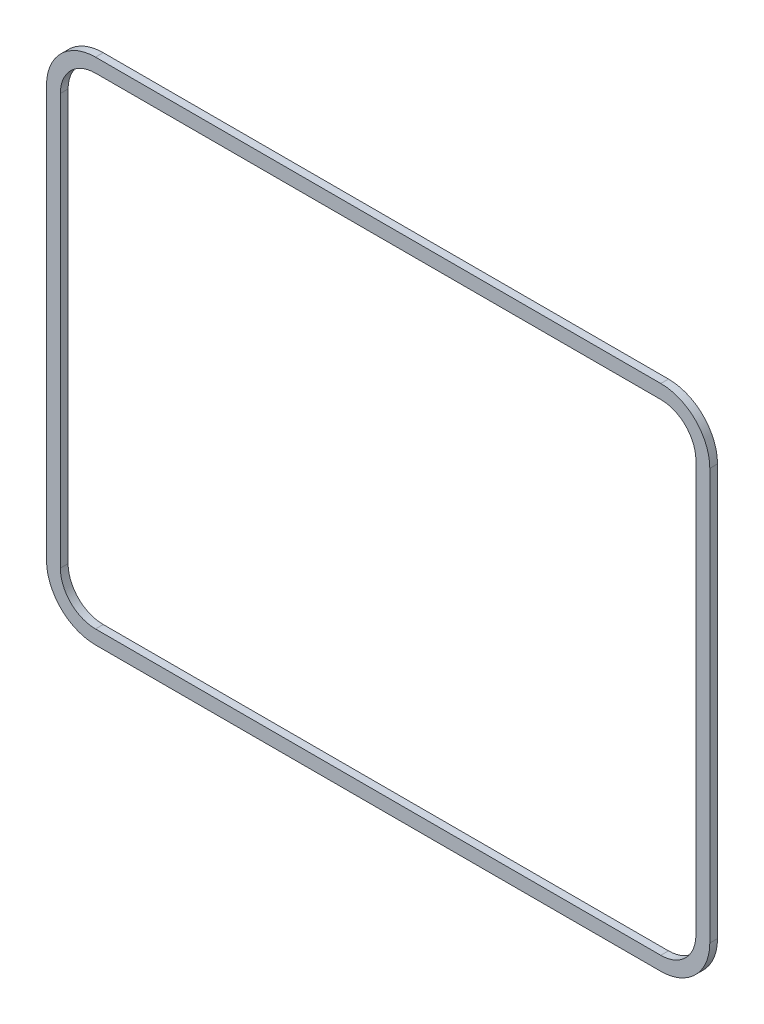
from build123d import *

# Parameters (mm, degrees)
BOSS_EXTRUDE1_DEPTH = 2.54


with BuildPart() as part:
    # Sketch1 → Boss-Extrude1 (new body)
    with BuildSketch(Plane.XY):
        with BuildLine():
            Line((-109.2454, -66.7), (-109.2454, 67.7))
            ThreePointArc((-109.2454, 67.7), (-104.516521825, 79.116521825), (-93.1, 83.8454))
            Line((-93.1, 83.8454), (92.1, 83.8454))
            Line((92.1, 83.8454), (93.1, 83.8454))
            ThreePointArc((93.1, 83.8454), (104.516521825, 79.116521825), (109.2454, 67.7))
            Line((109.2454, 67.7), (109.2454, -66.7))
            Line((109.2454, -66.7), (109.2454, -67.7))
            ThreePointArc((109.2454, -67.7), (104.516521825, -79.116521825), (93.1, -83.8454))
            Line((93.1, -83.8454), (-92.1, -83.8454))
            Line((-92.1, -83.8454), (-93.1, -83.8454))
            ThreePointArc((-93.1, -83.8454), (-104.516521825, -79.116521825), (-109.2454, -67.7))
            Line((-109.2454, -67.7), (-109.2454, -66.7))
        make_face()
        with BuildLine():
            Line((-104.6734, -66.7), (-104.6734, 67.7))
            ThreePointArc((-104.6734, 67.7), (-101.283629621, 75.883629621), (-93.1, 79.2734))
            Line((-93.1, 79.2734), (92.1, 79.2734))
            Line((92.1, 79.2734), (93.1, 79.2734))
            ThreePointArc((93.1, 79.2734), (101.283629621, 75.883629621), (104.6734, 67.7))
            Line((104.6734, 67.7), (104.6734, -66.7))
            Line((104.6734, -66.7), (104.6734, -67.7))
            ThreePointArc((104.6734, -67.7), (101.283629621, -75.883629621), (93.1, -79.2734))
            Line((93.1, -79.2734), (-92.1, -79.2734))
            Line((-92.1, -79.2734), (-93.1, -79.2734))
            ThreePointArc((-93.1, -79.2734), (-101.283629621, -75.883629621), (-104.6734, -67.7))
            Line((-104.6734, -67.7), (-104.6734, -66.7))
        make_face(mode=Mode.SUBTRACT)
    extrude(amount=-BOSS_EXTRUDE1_DEPTH)


solid = part.part
